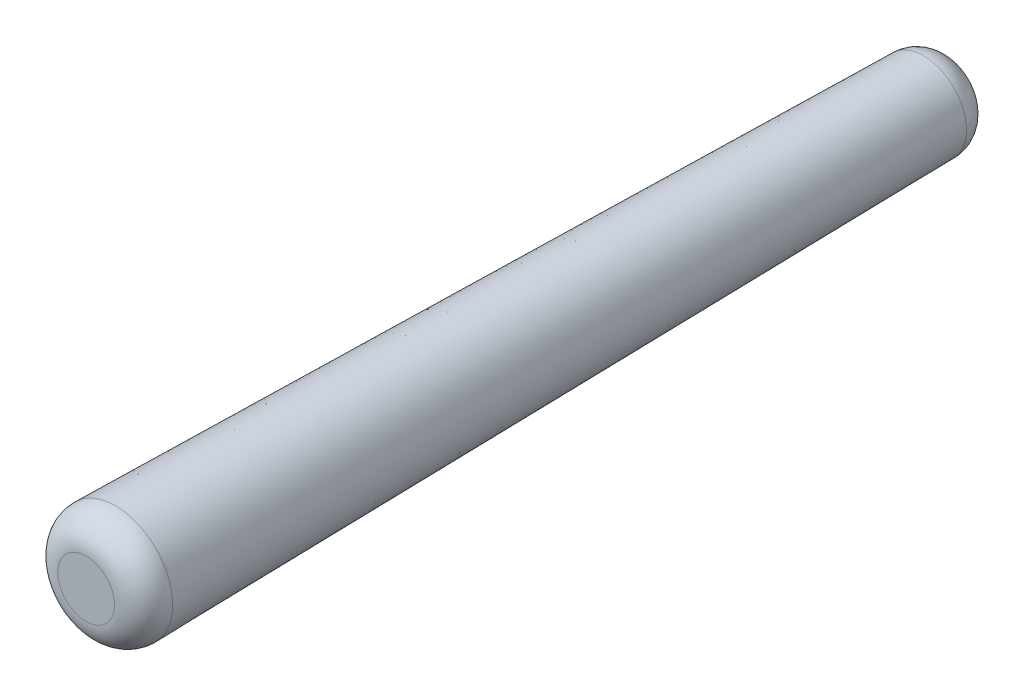
from build123d import *

# Parameters (mm, degrees)
SKETCH1_R           = 2
BOSS_EXTRUDE1_DEPTH = 30
BOSS_EXTRUDE1_DRAFT = -1
FILLET1_R           = 1


with BuildPart() as part:
    # Sketch1 → Boss-Extrude1 (with draft: the straight prism first)
    with BuildSketch(Plane.XY):
        Circle(SKETCH1_R)
    extrude(amount=-BOSS_EXTRUDE1_DEPTH)
    # Boss-Extrude1: the draft: its side faces are tilted about the plane it starts from
    boss_extrude1_sides = [part.faces().sort_by_distance(p)[0] for p in [
        (-2, 0, -15),
    ]]
    draft(boss_extrude1_sides, Plane.XY, BOSS_EXTRUDE1_DRAFT)

    # Fillet1
    fillet1_edges = [part.edges().sort_by_distance(p)[0] for p in [
        (-2, 0, 0),
        (-1.476348052, 0, -30),
    ]]
    fillet(fillet1_edges, radius=FILLET1_R)


solid = part.part
